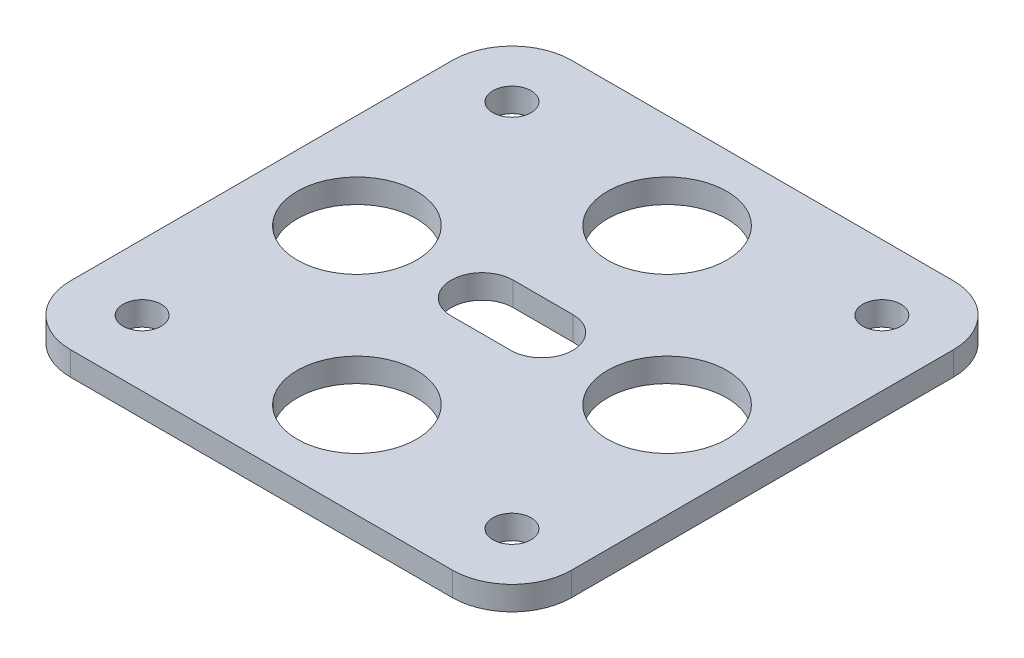
from build123d import *

# Parameters (mm, degrees)
SKETCH1_W           = 42
SKETCH1_H           = 42
SKETCH1_R           = 1.6
SKETCH1_R_2         = 5
BOSS_EXTRUDE1_DEPTH = 2
FILLET1_R           = 5


with BuildPart() as part:
    # Sketch1 → Boss-Extrude1 (new body)
    with BuildSketch(Plane(origin=(0, 0, 0), x_dir=(1, 0, 0), z_dir=(0, 1, 0))):
        Rectangle(SKETCH1_W, SKETCH1_H)
        with Locations(Location((15.5, 15.5, 0), (0, 0, 270))):
            Circle(SKETCH1_R, mode=Mode.SUBTRACT)
        with Locations(Location((-15.5, 15.5, 0), (0, 0, 90))):
            Circle(SKETCH1_R, mode=Mode.SUBTRACT)
        with Locations(Location((15.5, -15.5, 0), (0, 0, 90))):
            Circle(SKETCH1_R, mode=Mode.SUBTRACT)
        with Locations(Location((-15.5, -15.5, 0), (0, 0, 270))):
            Circle(SKETCH1_R, mode=Mode.SUBTRACT)
        with Locations(Location((0, 13, 0), (0, 0, 270))):
            Circle(SKETCH1_R_2, mode=Mode.SUBTRACT)
        with Locations(Location((13, 0, 0), (0, 0, 270))):
            Circle(SKETCH1_R_2, mode=Mode.SUBTRACT)
        with Locations(Location((0, -13, 0), (0, 0, 270))):
            Circle(SKETCH1_R_2, mode=Mode.SUBTRACT)
        with Locations(Location((-13, 0, 0), (0, 0, 270))):
            Circle(SKETCH1_R_2, mode=Mode.SUBTRACT)
        with BuildLine():
            Line((-2.5, 2.6), (2.5, 2.6))
            ThreePointArc((2.5, 2.6), (5.1, 0), (2.5, -2.6))
            Line((2.5, -2.6), (-2.5, -2.6))
            ThreePointArc((-2.5, -2.6), (-5.1, 0), (-2.5, 2.6))
        make_face(mode=Mode.SUBTRACT)
    extrude(amount=BOSS_EXTRUDE1_DEPTH)

    # Fillet1
    fillet1_edges = [part.edges().sort_by_distance(p)[0] for p in [
        (21, 1, 21),
        (-21, 1, 21),
        (-21, 1, -21),
        (21, 1, -21),
    ]]
    fillet(fillet1_edges, radius=FILLET1_R)


solid = part.part
